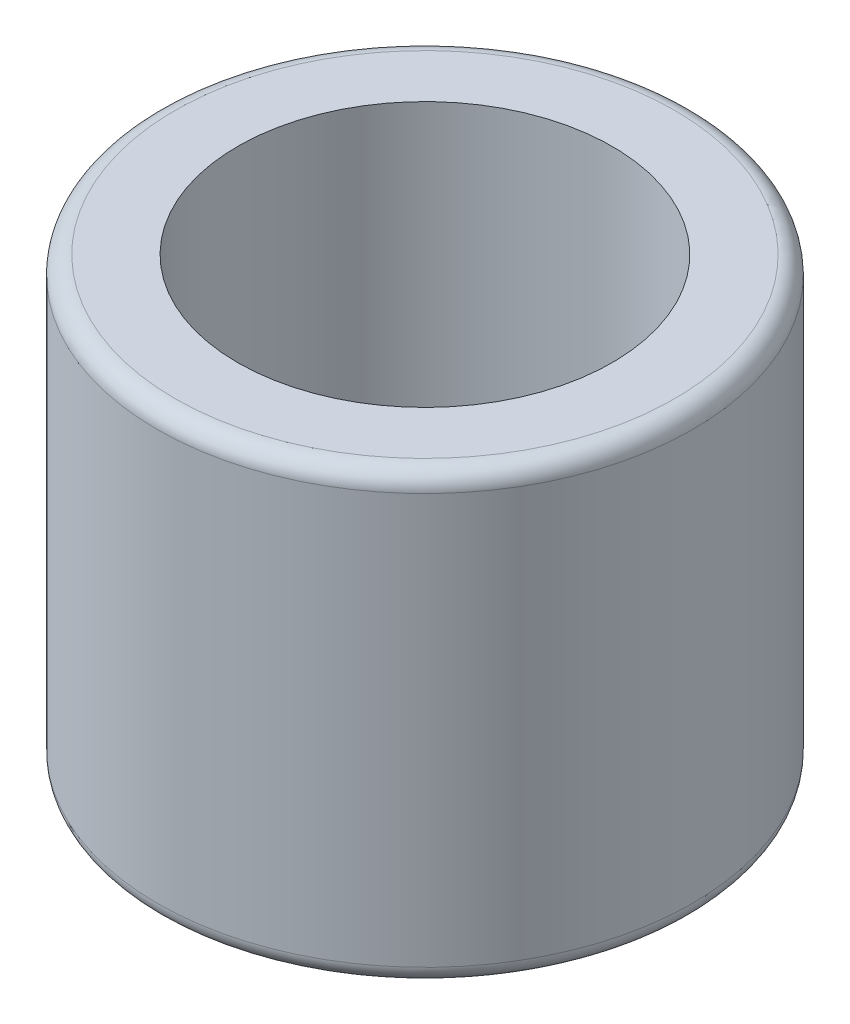
from build123d import *

# Parameters (mm, degrees)
SKETCH1_R           = 3.81
SKETCH1_R_2         = 2.667
BOSS_EXTRUDE1_DEPTH = 6.35
FILLET1_R           = 0.254


with BuildPart() as part:
    # Sketch1 → Boss-Extrude1 (new body)
    with BuildSketch(Plane(origin=(0, 0, 0), x_dir=(1, 0, 0), z_dir=(0, 1, 0))):
        with Locations(Location((0, 0, 0), (0, 0, 270))):
            Circle(SKETCH1_R)
        with Locations(Location((0, 0, 0), (0, 0, 270))):
            Circle(SKETCH1_R_2, mode=Mode.SUBTRACT)
    extrude(amount=BOSS_EXTRUDE1_DEPTH)

    # Fillet1
    fillet1_edges = [part.edges().sort_by_distance(p)[0] for p in [
        (0, 0, -3.81),
        (0, 6.35, -3.81),
    ]]
    fillet(fillet1_edges, radius=FILLET1_R)


solid = part.part
